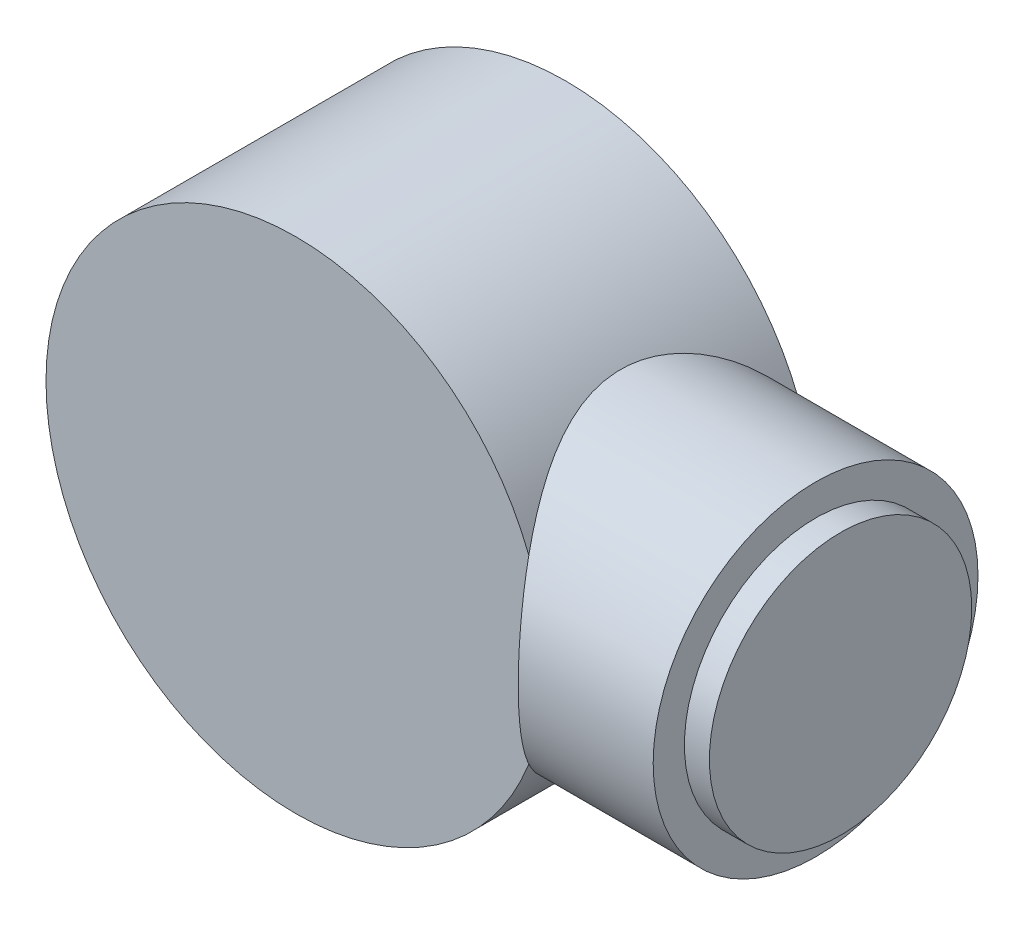
from build123d import *

# Parameters (mm, degrees)
SKETCH1_R                = 50
BOSS_EXTRUDE1_DEPTH      = 54
BOSS_EXTRUDE2_REACH      = 148.782
BOSS_EXTRUDE2_END_RADIUS = 50
SKETCH2_R                = 32.5
SKETCH3_R                = 26.25
BOSS_EXTRUDE3_DEPTH      = 5


with BuildPart() as part:
    # Sketch1 → Boss-Extrude1 (new body)
    with BuildSketch(Plane.XY):
        Circle(SKETCH1_R)
    extrude(amount=BOSS_EXTRUDE1_DEPTH)


with BuildPart() as body_2:
    # Boss-Extrude2: up to this cylinder (the profile starts outside it)
    boss_extrude2_end = Plane(origin=(0, 0, 27), z_dir=(0, 0, -1)) * Cylinder(BOSS_EXTRUDE2_END_RADIUS, 398.564, mode=Mode.PRIVATE)
    # Sketch2 → Boss-Extrude2 (new, up to the surface)
    with BuildSketch(Plane(origin=(77, 0, 0), x_dir=(0, 0, -1), z_dir=(1, 0, 0)), mode=Mode.PRIVATE) as boss_extrude2_sk1:
        with Locations((-27, 0)):
            Circle(SKETCH2_R)
    boss_extrude2_tool1 = extrude(boss_extrude2_sk1.sketch, amount=-BOSS_EXTRUDE2_REACH, mode=Mode.PRIVATE) - boss_extrude2_end
    add(boss_extrude2_tool1.solids().sort_by_distance((77, 0, 27))[0])

    # Sketch3 → Boss-Extrude3 (add)
    with BuildSketch(Plane(origin=(77, 0, 0), x_dir=(0, 0, -1), z_dir=(1, 0, 0))):
        with Locations((-27, 0)):
            Circle(SKETCH3_R)
    extrude(amount=BOSS_EXTRUDE3_DEPTH)


solid = Compound([part.part, body_2.part])
